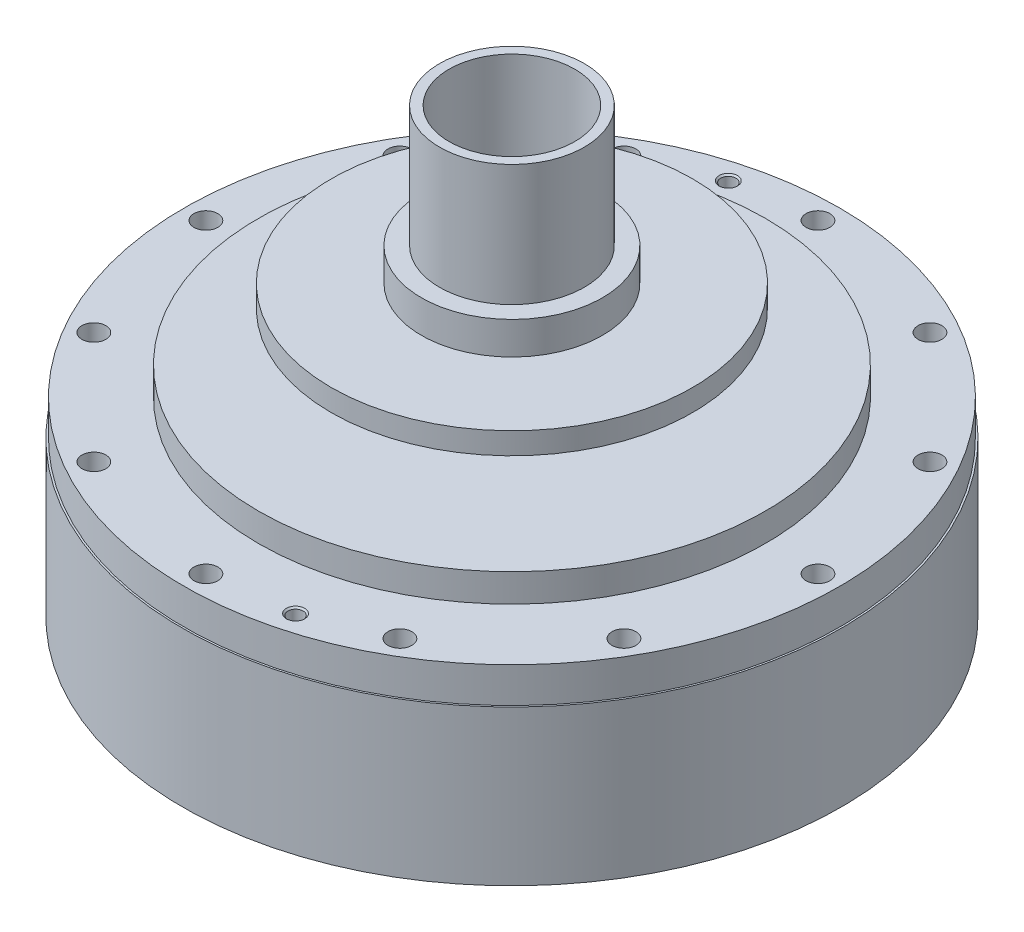
from build123d import *

# Parameters (mm, degrees)
SKETCH2_R                        = 33
CUT_EXTRUDE1_DEPTH               = 5.3
SKETCH3_R                        = 3.3
CUT_EXTRUDE2_DEPTH               = 178.522951756
M8X1_25_TAPPED_HOLE2_D           = 6.8
M8X1_25_TAPPED_HOLE2_DEPTH       = 23.75
M8X1_25_TAPPED_HOLE2_CSINK_D     = 8.05
M8X1_25_TAPPED_HOLE2_CSINK_ANGLE = 90
M8X1_25_TAPPED_HOLE2_TIP         = 2.042926105
M5X0_8_TAPPED_HOLE2_D            = 4.2
M5X0_8_TAPPED_HOLE2_CSINK_D      = 5.05
M5X0_8_TAPPED_HOLE2_CSINK_ANGLE  = 90


with BuildPart() as part:
    # Sketch1 → Revolve1 (revolve)
    with BuildSketch(Plane(origin=(0, 0, 0), x_dir=(0, 0, -1), z_dir=(1, 0, 0)), mode=Mode.PRIVATE) as revolve1_sk:
        Polygon((-17.35, 0), (-70, 0), (-70, 5.36), (-91, 5.36), (-91, 48.12), (-90.5, 48.12), (-90.5, 57.86), (-70, 57.86), (-70, 65.62), (-29.6, 65.62), (-29.6, 79.12), (-49.91, 79.12), (-49.91, 85.12), (-25, 85.12), (-25, 94.12), (-20, 94.12), (-20, 127.64), (-17.35, 127.64), align=None)
    revolve(revolve1_sk.sketch.rotate(Axis((0, -94.12, 0), (0, 1, 0)), 180), axis=Axis((0, -94.12, 0), (0, 1, 0)))

    # Sketch2 → Cut-Extrude1 (cut)
    with BuildSketch(Plane.XZ):
        with Locations(Location((0, 0, 0), (0, 0, 270))):
            Circle(SKETCH2_R)
    extrude(amount=-CUT_EXTRUDE1_DEPTH, mode=Mode.SUBTRACT)

    # Sketch3 → Cut-Extrude2 (cut, through all)
    with BuildSketch(Plane.XZ.offset(-5.36)):
        with Locations(Location((-84.5, 0, 0), (0, 0, 270))):
            Circle(SKETCH3_R)
        with Locations(Location((-73.17914662, 42.25, 0), (0, 0, 270))):
            Circle(SKETCH3_R)
        with Locations(Location((-42.25, 73.17914662, 0), (0, 0, 270))):
            Circle(SKETCH3_R)
        with Locations(Location((0, 84.5, 0), (0, 0, 270))):
            Circle(SKETCH3_R)
        with Locations(Location((42.25, 73.17914662, 0), (0, 0, 270))):
            Circle(SKETCH3_R)
        with Locations(Location((73.17914662, 42.25, 0), (0, 0, 270))):
            Circle(SKETCH3_R)
        with Locations(Location((84.5, 0, 0), (0, 0, 270))):
            Circle(SKETCH3_R)
        with Locations(Location((73.17914662, -42.25, 0), (0, 0, 270))):
            Circle(SKETCH3_R)
        with Locations(Location((42.25, -73.17914662, 0), (0, 0, 270))):
            Circle(SKETCH3_R)
        with Locations(Location((0, -84.5, 0), (0, 0, 270))):
            Circle(SKETCH3_R)
        with Locations(Location((-42.25, -73.17914662, 0), (0, 0, 270))):
            Circle(SKETCH3_R)
        with Locations(Location((-73.17914662, -42.25, 0), (0, 0, 270))):
            Circle(SKETCH3_R)
    extrude(amount=-CUT_EXTRUDE2_DEPTH, mode=Mode.SUBTRACT)

    # M8x1.25 Tapped Hole2
    with Locations(Plane(origin=(0, 0, 0), x_dir=(-1, 0, 0), z_dir=(0, -1, 0))):
        with Locations((15.011504616, 56.023697925), (-29, 50.229473419), (-56.023697925, 15.011504616), (-50.229473419, -29), (-15.011504616, -56.023697925), (29, -50.229473419), (56.023697925, -15.011504616), (50.229473419, 29)):
            CounterSinkHole(M8X1_25_TAPPED_HOLE2_D / 2, M8X1_25_TAPPED_HOLE2_CSINK_D / 2, depth=M8X1_25_TAPPED_HOLE2_DEPTH, counter_sink_angle=M8X1_25_TAPPED_HOLE2_CSINK_ANGLE)
            with Locations((0, 0, -(M8X1_25_TAPPED_HOLE2_DEPTH + M8X1_25_TAPPED_HOLE2_TIP / 2))):  # 118° drill point
                Cone(0, M8X1_25_TAPPED_HOLE2_D / 2, M8X1_25_TAPPED_HOLE2_TIP, mode=Mode.SUBTRACT)

    # M5x0.8 Tapped Hole2 (through all)
    with Locations(Plane(origin=(0, 57.86, 0), x_dir=(1, 0, 0), z_dir=(0, 1, 0))):
        with Locations((-21.870209311, 81.620732321), (21.870209311, -81.620732321)):
            CounterSinkHole(M5X0_8_TAPPED_HOLE2_D / 2, M5X0_8_TAPPED_HOLE2_CSINK_D / 2, counter_sink_angle=M5X0_8_TAPPED_HOLE2_CSINK_ANGLE)


solid = part.part
